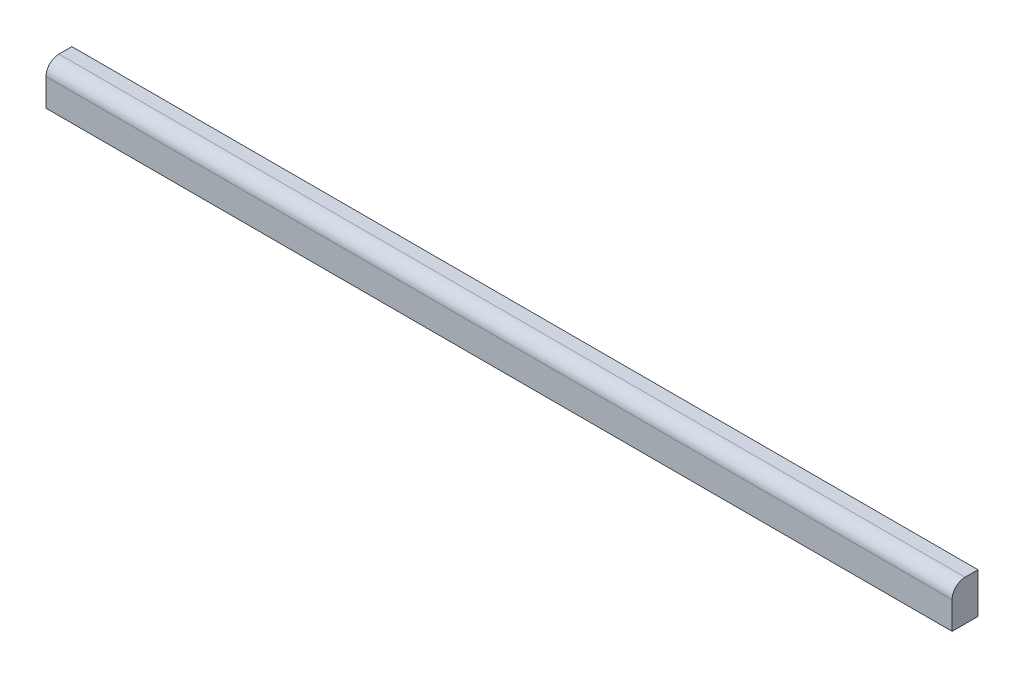
from build123d import *

# Parameters (mm, degrees)
SKETCH1_W           = 560
SKETCH1_H           = 25
BOSS_EXTRUDE1_DEPTH = 16
FILLET1_R           = 8


with BuildPart() as part:
    # Sketch1 → Boss-Extrude1 (new body)
    with BuildSketch(Plane.XY):
        with Locations((0, 12.5)):
            Rectangle(SKETCH1_W, SKETCH1_H)
    extrude(amount=BOSS_EXTRUDE1_DEPTH)

    # Fillet1
    fillet1_edges = [part.edges().sort_by_distance(p)[0] for p in [
        (0, 25, 16),
    ]]
    fillet(fillet1_edges, radius=FILLET1_R)


solid = part.part
